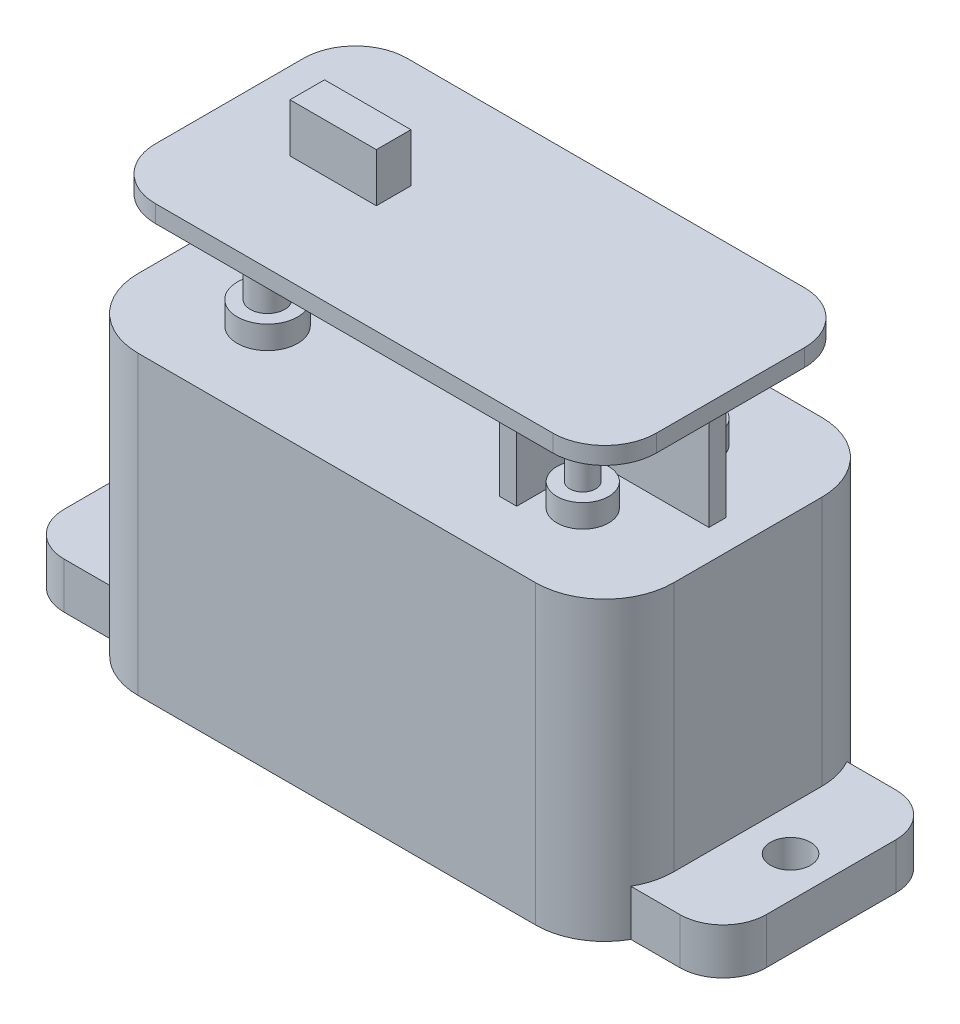
from build123d import *

# Parameters (mm, degrees)
SKETCH1_R           = 2.32
BOSS_EXTRUDE1_DEPTH = 5.33
BOSS_EXTRUDE2_DEPTH = 34.32
SKETCH3_R           = 3.5
SKETCH3_R_2         = 3
BOSS_EXTRUDE3_DEPTH = 2.66
SKETCH4_R           = 2
SKETCH4_R_2         = 1.5
BOSS_EXTRUDE4_DEPTH = 8
BOSS_EXTRUDE5_DEPTH = 12
BOSS_EXTRUDE6_DEPTH = 2
SKETCH7_W           = 10
SKETCH7_H           = 4
BOSS_EXTRUDE7_DEPTH = 5.63


with BuildPart() as part:
    # Sketch1 → Boss-Extrude1 (new body)
    with BuildSketch(Plane(origin=(0, 0, 0), x_dir=(1, 0, 0), z_dir=(0, 1, 0))):
        with BuildLine():
            Line((35.64, -12.5), (-35.64, -12.5))
            ThreePointArc((-35.64, -12.5), (-39.175533906, -11.035533906), (-40.64, -7.5))
            Line((-40.64, -7.5), (-40.64, 7.5))
            ThreePointArc((-40.64, 7.5), (-39.175533906, 11.035533906), (-35.64, 12.5))
            Line((-35.64, 12.5), (35.64, 12.5))
            ThreePointArc((35.64, 12.5), (39.175533906, 11.035533906), (40.64, 7.5))
            Line((40.64, 7.5), (40.64, -7.5))
            ThreePointArc((40.64, -7.5), (39.175533906, -11.035533906), (35.64, -12.5))
        make_face()
        with Locations(Location((-35.95, 0, 0), (0, 0, 270))):
            Circle(SKETCH1_R, mode=Mode.SUBTRACT)
        with Locations(Location((35.95, 0, 0), (0, 0, 270))):
            Circle(SKETCH1_R, mode=Mode.SUBTRACT)
    extrude(amount=BOSS_EXTRUDE1_DEPTH)

    # Sketch2 → Boss-Extrude2 (add)
    with BuildSketch(Plane.XZ):
        with BuildLine():
            Line((23, 16.57), (-23, 16.57))
            ThreePointArc((-23, 16.57), (-28.656854249, 14.226854249), (-31, 8.57))
            Line((-31, 8.57), (-31, -8.57))
            ThreePointArc((-31, -8.57), (-28.656854249, -14.226854249), (-23, -16.57))
            Line((-23, -16.57), (23, -16.57))
            ThreePointArc((23, -16.57), (28.656854249, -14.226854249), (31, -8.57))
            Line((31, -8.57), (31, 8.57))
            ThreePointArc((31, 8.57), (28.656854249, 14.226854249), (23, 16.57))
        make_face()
    extrude(amount=-BOSS_EXTRUDE2_DEPTH)

    # Sketch3 → Boss-Extrude3 (add)
    with BuildSketch(Plane(origin=(0, 34.32, 0), x_dir=(1, 0, 0), z_dir=(0, 1, 0))):
        with Locations(Location((-18.25, 6.35, 0), (0, 0, 270))):
            Circle(SKETCH3_R)
        with Locations(Location((-18.25, -6.35, 0), (0, 0, 270))):
            Circle(SKETCH3_R)
        with Locations(Location((18.25, -6.35, 0), (0, 0, 270))):
            Circle(SKETCH3_R_2)
        with Locations(Location((18.25, 6.35, 0), (0, 0, 270))):
            Circle(SKETCH3_R_2)
    extrude(amount=BOSS_EXTRUDE3_DEPTH)

    # Sketch4 → Boss-Extrude4 (add)
    with BuildSketch(Plane(origin=(0, 36.98, 0), x_dir=(1, 0, 0), z_dir=(0, 1, 0))):
        with Locations(Location((-18.25, 6.35, 0), (0, 0, 270))):
            Circle(SKETCH4_R)
        with Locations(Location((-18.25, -6.35, 0), (0, 0, 270))):
            Circle(SKETCH4_R)
        with Locations(Location((18.25, 6.35, 0), (0, 0, 270))):
            Circle(SKETCH4_R_2)
        with Locations(Location((18.25, -6.35, 0), (0, 0, 270))):
            Circle(SKETCH4_R_2)
    extrude(amount=BOSS_EXTRUDE4_DEPTH)

    # Sketch5 → Boss-Extrude5 (add)
    with BuildSketch(Plane(origin=(0, 34.32, 0), x_dir=(1, 0, 0), z_dir=(0, 1, 0))):
        Polygon((12.25, 1), (-27.5, 1), (-27.5, -1), (12.25, -1), (12.25, -10), (14.25, -10), (14.25, -1), (27.5, -1), (27.5, 1), (14.25, 1), (14.25, 10), (12.25, 10), align=None)
    extrude(amount=BOSS_EXTRUDE5_DEPTH)

    # Sketch6 → Boss-Extrude6 (add)
    with BuildSketch(Plane(origin=(0, 46.32, 0), x_dir=(1, 0, 0), z_dir=(0, 1, 0))):
        with BuildLine():
            Line((-29, 8.57), (-29, -8.57))
            ThreePointArc((-29, -8.57), (-27.242640687, -12.812640687), (-23, -14.57))
            Line((-23, -14.57), (23, -14.57))
            ThreePointArc((23, -14.57), (27.242640687, -12.812640687), (29, -8.57))
            Line((29, -8.57), (29, 8.57))
            ThreePointArc((29, 8.57), (27.242640687, 12.812640687), (23, 14.57))
            Line((23, 14.57), (-23, 14.57))
            ThreePointArc((-23, 14.57), (-27.242640687, 12.812640687), (-29, 8.57))
        make_face()
    extrude(amount=BOSS_EXTRUDE6_DEPTH)

    # Sketch7 → Boss-Extrude7 (add)
    with BuildSketch(Plane(origin=(0, 48.32, 0), x_dir=(1, 0, 0), z_dir=(0, 1, 0))):
        with Locations((-15, 0)):
            Rectangle(SKETCH7_W, SKETCH7_H)
    extrude(amount=BOSS_EXTRUDE7_DEPTH)


solid = part.part
